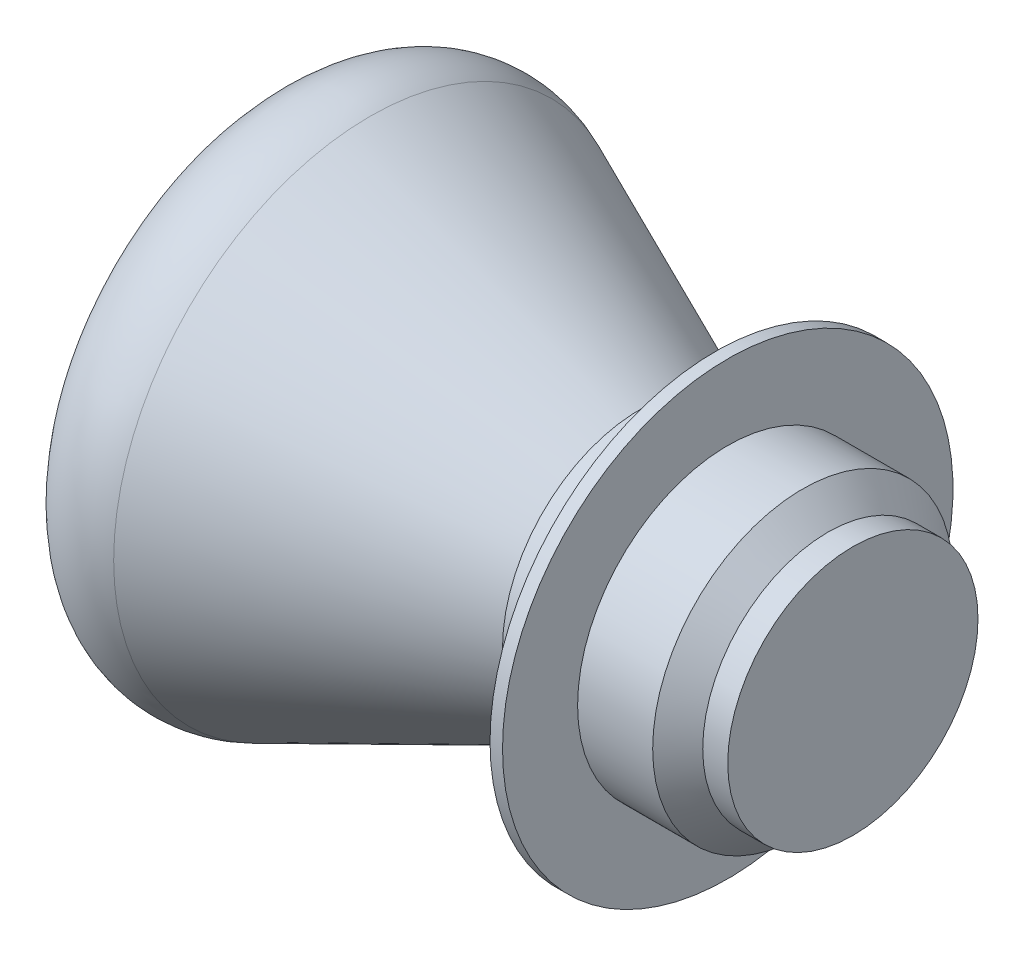
from build123d import *


with BuildPart() as part:
    # Sketch2 → Revolve1 (revolve)
    with BuildSketch(Plane.XY, mode=Mode.PRIVATE) as revolve1_sk:
        Polygon((0, 0), (5.5, 0), (5.5, 5), (4.5, 5), (3.5, 6), (0.5, 6), (0.5, 9), (0, 9), (0, 6), (-2, 6), (-2, 5.5), (0, 5.5), align=None)
    revolve(revolve1_sk.sketch.rotate(Axis((0, 0, 0), (1, 0, 0)), 90), axis=Axis((0, 0, 0), (1, 0, 0)))


with BuildPart() as body_2:
    # Sketch3 → Revolve2 (revolve)
    with BuildSketch(Plane.XY, mode=Mode.PRIVATE) as revolve2_sk:
        with BuildLine():
            Line((0, 5.5), (-3, 5.5))
            Line((-3, 5.5), (-13.792304346, 10.246173922))
            ThreePointArc((-13.792304346, 10.246173922), (-16.249914373, 10.227217274), (-17.868664312, 8.377932268))
            ThreePointArc((-17.868664312, 8.377932268), (-18.806913336, 4.235579525), (-19.121974552, 0))
            Line((-19.121974552, 0), (0, 0))
            Line((0, 0), (0, 5.5))
        make_face()
    revolve(revolve2_sk.sketch.rotate(Axis((-19.121974552, 0, 0), (1, 0, 0)), 90), axis=Axis((-19.121974552, 0, 0), (1, 0, 0)))


solid = Compound([part.part, body_2.part])
